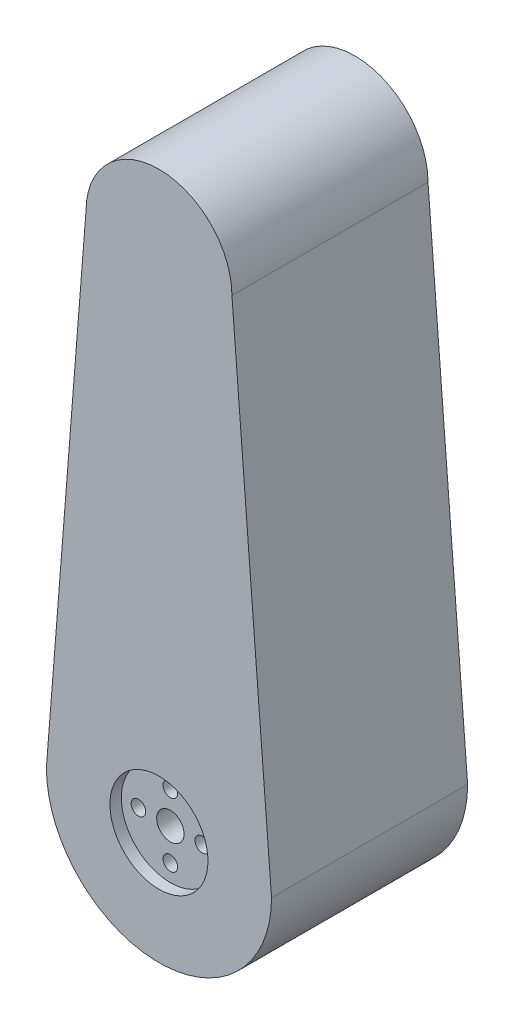
from build123d import *

# Parameters (mm, degrees)
BOSS_EXTRUDE1_DEPTH = 21.5
SKETCH2_R           = 10.75
CUT_EXTRUDE1_DEPTH  = 2.5
SKETCH3_R           = 3
SKETCH3_R_2         = 1.6
CUT_EXTRUDE2_DEPTH  = 10
SKETCH4_R           = 4
BOSS_EXTRUDE2_DEPTH = 6
SKETCH6_W           = 12.8
SKETCH6_H           = 23.5
CUT_EXTRUDE3_DEPTH  = 18
SKETCH8_R           = 1
CUT_EXTRUDE4_DEPTH  = 8


with BuildPart() as part:
    # Sketch1 → Boss-Extrude1 (new, symmetric)
    with BuildSketch(Plane.XY):
        with BuildLine():
            Line((16, 110), (24.685901916, 0))
            ThreePointArc((24.685901916, 0), (0, -24.685901916), (-24.685901916, 0))
            Line((-24.685901916, 0), (-16, 110))
            ThreePointArc((-16, 110), (0, 126), (16, 110))
        make_face()
    extrude(amount=BOSS_EXTRUDE1_DEPTH, both=True)

    # Sketch2 → Cut-Extrude1 (cut)
    with BuildSketch(Plane.XY.offset(21.5)):
        Circle(SKETCH2_R)
    extrude(amount=-CUT_EXTRUDE1_DEPTH, mode=Mode.SUBTRACT)

    # Sketch3 → Cut-Extrude2 (cut)
    with BuildSketch(Plane.XY.offset(19)):
        Circle(SKETCH3_R)
        with Locations((0, 7)):
            Circle(SKETCH3_R_2)
        with Locations((7, 0)):
            Circle(SKETCH3_R_2)
        with Locations((0, -7)):
            Circle(SKETCH3_R_2)
        with Locations((-7, 0)):
            Circle(SKETCH3_R_2)
    extrude(amount=-CUT_EXTRUDE2_DEPTH, mode=Mode.SUBTRACT)

    # Sketch4 → Boss-Extrude2 (add)
    with BuildSketch(Plane(origin=(0, 0, -21.5), x_dir=(-1, 0, 0), z_dir=(0, 0, -1))):
        Circle(SKETCH4_R)
    extrude(amount=BOSS_EXTRUDE2_DEPTH)

    # Sketch6 → Cut-Extrude3 (cut)
    with BuildSketch(Plane(origin=(0, 0, -21.5), x_dir=(-1, 0, 0), z_dir=(0, 0, -1))):
        with Locations((0, 104.25)):
            Rectangle(SKETCH6_W, SKETCH6_H)
    extrude(amount=-CUT_EXTRUDE3_DEPTH, mode=Mode.SUBTRACT)

    # Sketch8 → Cut-Extrude4 (cut)
    with BuildSketch(Plane(origin=(0, 0, -21.5), x_dir=(-1, 0, 0), z_dir=(0, 0, -1))):
        with Locations((0, 118.6)):
            Circle(SKETCH8_R)
        with Locations((0, 89.9)):
            Circle(SKETCH8_R)
    extrude(amount=-CUT_EXTRUDE4_DEPTH, mode=Mode.SUBTRACT)


solid = part.part
